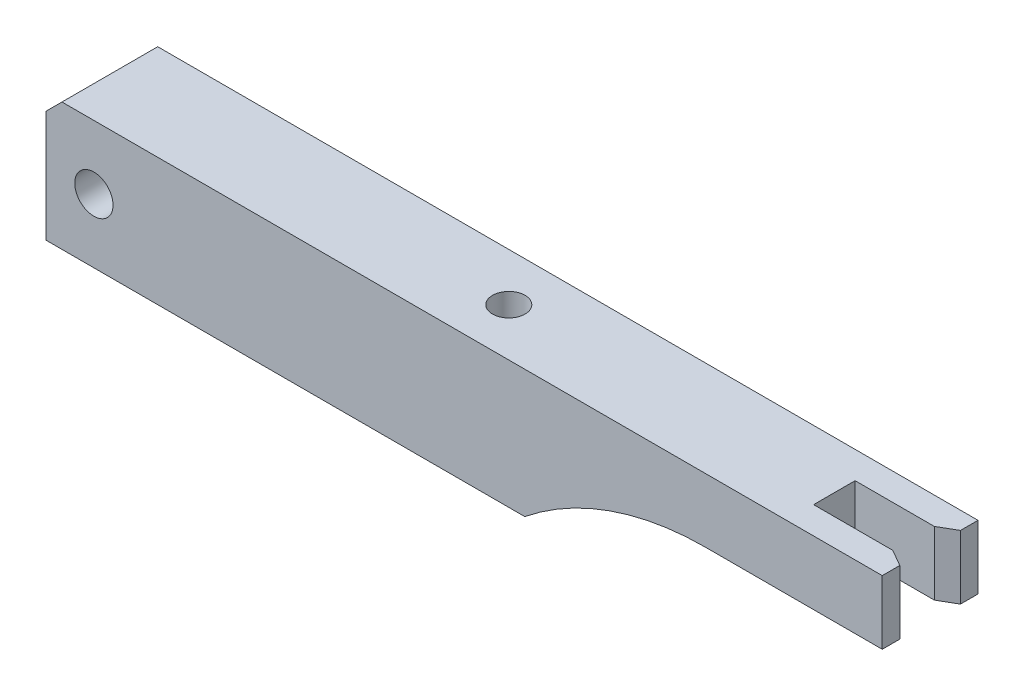
from build123d import *
from OCP.BRepFilletAPI import BRepFilletAPI_MakeChamfer

# Parameters (mm, degrees)
MAIN_BODY_DEPTH            = 15
F_12_0_12_DIAMETER_HOLE1_D = 12
M12X1_75_TAPPED_HOLE2_D    = 10.2
SKETCH4_W                  = 30
SKETCH4_H                  = 13
CUT_OUT_DEPTH              = 139.740765458
C_FER_5_X_45_SIZE          = 5
C_FER_3_X_30_SIZE          = 3
C_FER_3_X_30_SIZE2         = 5.196152423


with BuildPart() as part:
    # Sketch1 → main body (new, symmetric)
    with BuildSketch(Plane.XY):
        with BuildLine():
            Line((20, 0), (-130, 0))
            Line((-130, 0), (-130, 40))
            Line((-130, 40), (132, 40))
            Line((132, 40), (132, 20))
            Line((132, 20), (76.568542495, 20))
            ThreePointArc((76.568542495, 20), (46.568542495, 14.852813742), (20, 0))
        make_face()
    extrude(amount=MAIN_BODY_DEPTH, both=True)

    # Ø12.0 (12) Diameter Hole1 (through all)
    with Locations(Plane(origin=(-115, 20, 15), x_dir=(1, 0, 0), z_dir=(0, 0, 1))):
        with Locations((0, 0)):
            Hole(F_12_0_12_DIAMETER_HOLE1_D / 2)

    # M12x1.75 Tapped Hole2 (through all)
    with Locations(Plane(origin=(0, 40, 0), x_dir=(-1, 0, 0), z_dir=(0, 1, 0))):
        with Locations((0, 0)):
            Hole(M12X1_75_TAPPED_HOLE2_D / 2)

    # Sketch4 → cut out (cut, through all)
    with BuildSketch(Plane(origin=(0, 40, 0), x_dir=(1, 0, 0), z_dir=(0, 1, 0))):
        with Locations((117, 0)):
            Rectangle(SKETCH4_W, SKETCH4_H)
    extrude(amount=-CUT_OUT_DEPTH, mode=Mode.SUBTRACT)

    # C'FER 5 x 45
    c_fer_5_x_45_edges = [part.edges().sort_by_distance(p)[0] for p in [
        (-130, 40, 0),
    ]]
    chamfer(c_fer_5_x_45_edges, length=C_FER_5_X_45_SIZE)

    # C'FER 3 x 30: one chamfer whose edges measure the first distance from different faces: ONE call of the kernel's chamfer builder (chamfer() names one face for all edges)
    c_fer_3_x_30_edges_1 = [part.edges().sort_by_distance(p)[0] for p in [
        (132, 30, -6.5),
    ]]
    c_fer_3_x_30_side_1 = [part.faces().sort_by_distance(p)[0] for p in [
        (132, 30, -10.75),
    ]]
    c_fer_3_x_30_edges_2 = [part.edges().sort_by_distance(p)[0] for p in [
        (132, 30, 6.5),
    ]]
    c_fer_3_x_30_side_2 = [part.faces().sort_by_distance(p)[0] for p in [
        (132, 30, 10.75),
    ]]
    c_fer_3_x_30 = BRepFilletAPI_MakeChamfer(part.part.solid().wrapped)
    for e in c_fer_3_x_30_edges_1:
        c_fer_3_x_30.Add(C_FER_3_X_30_SIZE, C_FER_3_X_30_SIZE2, e.wrapped, c_fer_3_x_30_side_1[0].wrapped)  # the first distance lies on this face
    for e in c_fer_3_x_30_edges_2:
        c_fer_3_x_30.Add(C_FER_3_X_30_SIZE, C_FER_3_X_30_SIZE2, e.wrapped, c_fer_3_x_30_side_2[0].wrapped)  # the first distance lies on this face
    add(Compound.cast(c_fer_3_x_30.Shape()), mode=Mode.REPLACE)


solid = part.part
